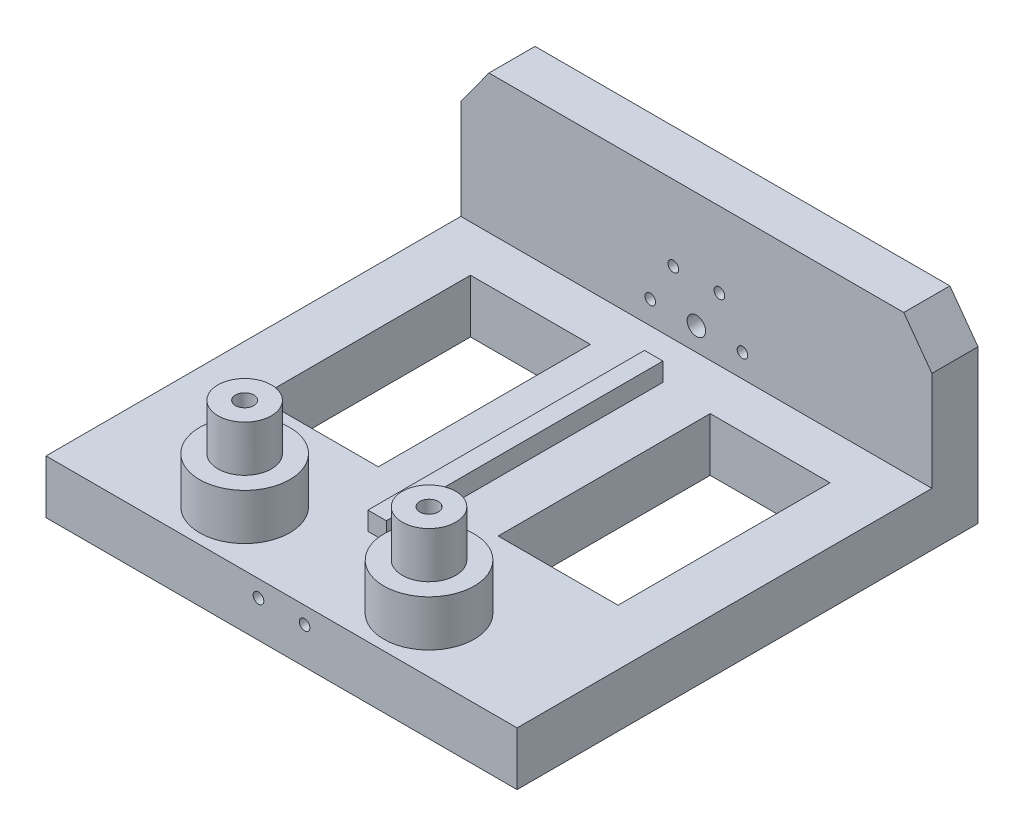
from build123d import *

# Parameters (mm, degrees)
SKETCH1_R               = 1
SKETCH1_R_2             = 0.575
BOSS_EXTRUDE1_DEPTH     = 5
SKETCH2_R               = 0.575
BOSS_EXTRUDE2_DEPTH     = 45
SKETCH4_W               = 2
SKETCH4_H               = 30
BOSS_EXTRUDE3_DEPTH     = 2
SKETCH5_W               = 13
SKETCH5_H               = 23
CUT_EXTRUDE1_DEPTH      = 16
SKETCH6_R               = 2.9
BOSS_EXTRUDE4_DEPTH     = 10
CUT_EXTRUDE2_DEPTH      = 60.605474742
CUT_EXTRUDE2_DEPTH_BACK = 60.605474742
SKETCH7_R               = 1
SKETCH11_R              = 4.9
SKETCH11_R_2            = 2.9
BOSS_EXTRUDE5_DEPTH     = 5
CUT_EXTRUDE4_DEPTH      = 73.577548022
CUT_EXTRUDE4_DEPTH_BACK = 73.577548022


with BuildPart() as part:
    # Sketch1 → Boss-Extrude1 (new body)
    with BuildSketch(Plane.XY):
        Polygon((-22.5, 12.5), (22.5, 12.5), (25.550198027, 8.301762582), (25.550198027, -8.301762582), (22.5, -12.5), (-22.5, -12.5), (-25.550198027, -8.301762582), (-25.550198027, 8.301762582), align=None)
        Circle(SKETCH1_R, mode=Mode.SUBTRACT)
        with Locations((-5, 0)):
            Circle(SKETCH1_R_2, mode=Mode.SUBTRACT)
        with Locations((-2.5, 4.330127019)):
            Circle(SKETCH1_R_2, mode=Mode.SUBTRACT)
        with Locations((2.5, 4.330127019)):
            Circle(SKETCH1_R_2, mode=Mode.SUBTRACT)
        with Locations((5, 0)):
            Circle(SKETCH1_R_2, mode=Mode.SUBTRACT)
        with Locations((2.5, -4.330127019)):
            Circle(SKETCH1_R_2, mode=Mode.SUBTRACT)
        with Locations((-2.5, -4.330127019)):
            Circle(SKETCH1_R_2, mode=Mode.SUBTRACT)
    extrude(amount=BOSS_EXTRUDE1_DEPTH)

    # Sketch2 → Boss-Extrude2 (add)
    with BuildSketch(Plane.XY.offset(5)):
        Polygon((25.550198027, -2.5), (-25.550198027, -2.5), (-25.550198027, -8.301762582), (-22.5, -12.5), (22.5, -12.5), (25.550198027, -8.301762582), align=None)
        with Locations((-2.5, -4.330127019)):
            Circle(SKETCH2_R, mode=Mode.SUBTRACT)
        with Locations((2.5, -4.330127019)):
            Circle(SKETCH2_R, mode=Mode.SUBTRACT)
    extrude(amount=BOSS_EXTRUDE2_DEPTH)

    # Sketch4 → Boss-Extrude3 (add)
    with BuildSketch(Plane(origin=(0, -2.5, 0), x_dir=(1, 0, 0), z_dir=(0, 1, 0))):
        with Locations((0, -24.628925384)):
            Rectangle(SKETCH4_W, SKETCH4_H)
    extrude(amount=BOSS_EXTRUDE3_DEPTH)

    # Sketch5 → Cut-Extrude1 (cut)
    with BuildSketch(Plane(origin=(0, -2.5, 0), x_dir=(1, 0, 0), z_dir=(0, 1, 0))):
        with Locations((13, -21.5)):
            Rectangle(SKETCH5_W, SKETCH5_H)
        with Locations((-13, -21.5)):
            Rectangle(SKETCH5_W, SKETCH5_H)
    extrude(amount=-CUT_EXTRUDE1_DEPTH, mode=Mode.SUBTRACT)

    # Sketch6 → Boss-Extrude4 (add)
    with BuildSketch(Plane(origin=(0, -2.5, 0), x_dir=(1, 0, 0), z_dir=(0, 1, 0))):
        with Locations(Location((10, -44, 0), (0, 0, 270))):
            Circle(SKETCH6_R)
        with Locations(Location((-10, -44, 0), (0, 0, 90))):
            Circle(SKETCH6_R)
    extrude(amount=BOSS_EXTRUDE4_DEPTH)

    # Sketch7 → Cut-Extrude2 (cut, two sides: drawn at the far end of the back side and taken through both)
    with BuildSketch(Plane(origin=(0, 7.5, 0), x_dir=(1, 0, 0), z_dir=(0, 1, 0)).offset(-CUT_EXTRUDE2_DEPTH_BACK)):
        with Locations(Location((10, -44, 0), (0, 0, 270))):
            Circle(SKETCH7_R)
        with Locations(Location((-10, -44, 0), (0, 0, 270))):
            Circle(SKETCH7_R)
    extrude(amount=CUT_EXTRUDE2_DEPTH + CUT_EXTRUDE2_DEPTH_BACK, mode=Mode.SUBTRACT)

    # Sketch11 → Boss-Extrude5 (add)
    # profile 1 of 2: a face of its own
    with BuildSketch(Plane(origin=(0, -2.5, 0), x_dir=(1, 0, 0), z_dir=(0, 1, 0))):
        with Locations(Location((-10, -44, 0), (0, 0, 270))):
            Circle(SKETCH11_R)
        with Locations(Location((-10, -44, 0), (0, 0, 90))):
            Circle(SKETCH11_R_2, mode=Mode.SUBTRACT)
    # profile 2 of 2: a face of its own
    with BuildSketch(Plane(origin=(0, -2.5, 0), x_dir=(1, 0, 0), z_dir=(0, 1, 0))):
        with Locations(Location((10, -44, 0), (0, 0, 270))):
            Circle(SKETCH11_R)
        with Locations(Location((10, -44, 0), (0, 0, 270))):
            Circle(SKETCH11_R_2, mode=Mode.SUBTRACT)
    extrude(amount=BOSS_EXTRUDE5_DEPTH)

    # Sketch13 → Cut-Extrude4 (cut, two sides: drawn at the far end of the back side and taken through both)
    with BuildSketch(Plane.ZY.offset(25.550198027).offset(-CUT_EXTRUDE4_DEPTH_BACK)):
        Polygon((0, -8.301762582), (-5.234948532, -12.24807669), (12.300258877, -20.537447465), (51.143400136, -17.827460865), (57.147880249, -8.301762582), (50, -8.301762582), align=None)
    extrude(amount=CUT_EXTRUDE4_DEPTH + CUT_EXTRUDE4_DEPTH_BACK, mode=Mode.SUBTRACT)


solid = part.part
